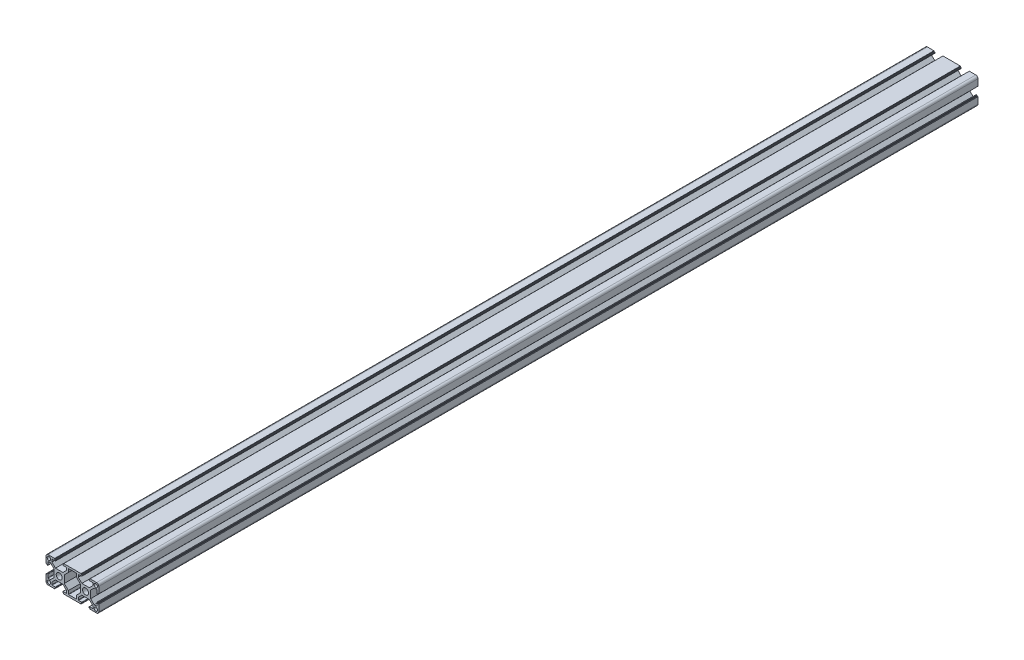
from build123d import *

# Parameters (mm, degrees)
SKETCH_1_R      = 2
SKETCH_1_R_2    = 3.4
EXTRUDE_1_DEPTH = 1000


with BuildPart() as part:
    # 草图1 → 凸台-拉伸1 (new body)
    with BuildSketch(Plane.XY):
        with BuildLine():
            Line((-10.924024871, 14.554539202), (-18.324024871, 14.554539202))
            Line((-18.324024871, 14.554539202), (-18.324024871, 13.754539202))
            ThreePointArc((-18.324024871, 13.754539202), (-18.382603515, 13.613117846), (-18.524024871, 13.554539202))
            Line((-18.524024871, 13.554539202), (-19.324024871, 13.554539202))
            Line((-19.324024871, 13.554539202), (-19.324024871, 12.654539202))
            ThreePointArc((-19.324024871, 12.654539202), (-19.236156905, 12.442407168), (-19.024024871, 12.354539202))
            Line((-19.024024871, 12.354539202), (-15.474024871, 12.354539202))
            ThreePointArc((-15.474024871, 12.354539202), (-15.261892836, 12.266671237), (-15.174024871, 12.054539202))
            Line((-15.174024871, 12.054539202), (-15.174024871, 9.360174121))
            Line((-15.174024871, 9.360174121), (-19.179659789, 5.354539202))
            Line((-19.179659789, 5.354539202), (-27.668389952, 5.354539202))
            Line((-27.668389952, 5.354539202), (-31.674024871, 9.360174121))
            Line((-31.674024871, 9.360174121), (-31.674024871, 12.054539202))
            ThreePointArc((-31.674024871, 12.054539202), (-31.586156905, 12.266671237), (-31.374024871, 12.354539202))
            Line((-31.374024871, 12.354539202), (-27.824024871, 12.354539202))
            ThreePointArc((-27.824024871, 12.354539202), (-27.611892836, 12.442407168), (-27.524024871, 12.654539202))
            Line((-27.524024871, 12.654539202), (-27.524024871, 13.554539202))
            Line((-27.524024871, 13.554539202), (-28.324024871, 13.554539202))
            ThreePointArc((-28.324024871, 13.554539202), (-28.465446227, 13.613117846), (-28.524024871, 13.754539202))
            Line((-28.524024871, 13.754539202), (-28.524024871, 14.554539202))
            Line((-28.524024871, 14.554539202), (-35.924024871, 14.554539202))
            ThreePointArc((-35.924024871, 14.554539202), (-37.691791824, 13.822306155), (-38.424024871, 12.054539202))
            Line((-38.424024871, 12.054539202), (-38.424024871, 4.654539202))
            Line((-38.424024871, 4.654539202), (-37.624024871, 4.654539202))
            ThreePointArc((-37.624024871, 4.654539202), (-37.482603515, 4.595960558), (-37.424024871, 4.454539202))
            Line((-37.424024871, 4.454539202), (-37.424024871, 3.654539202))
            Line((-37.424024871, 3.654539202), (-36.524024871, 3.654539202))
            ThreePointArc((-36.524024871, 3.654539202), (-36.311892836, 3.742407168), (-36.224024871, 3.954539202))
            Line((-36.224024871, 3.954539202), (-36.224024871, 7.504539202))
            ThreePointArc((-36.224024871, 7.504539202), (-36.136156905, 7.716671237), (-35.924024871, 7.804539202))
            Line((-35.924024871, 7.804539202), (-33.229659789, 7.804539202))
            Line((-33.229659789, 7.804539202), (-29.224024871, 3.798904284))
            Line((-29.224024871, 3.798904284), (-29.224024871, -4.689825879))
            Line((-29.224024871, -4.689825879), (-33.229659789, -8.695460798))
            Line((-33.229659789, -8.695460798), (-35.924024871, -8.695460798))
            ThreePointArc((-35.924024871, -8.695460798), (-36.136156905, -8.607592832), (-36.224024871, -8.395460798))
            Line((-36.224024871, -8.395460798), (-36.224024871, -4.845460798))
            ThreePointArc((-36.224024871, -4.845460798), (-36.311892836, -4.633328763), (-36.524024871, -4.545460798))
            Line((-36.524024871, -4.545460798), (-37.424024871, -4.545460798))
            Line((-37.424024871, -4.545460798), (-37.424024871, -5.345460798))
            ThreePointArc((-37.424024871, -5.345460798), (-37.482603515, -5.486882154), (-37.624024871, -5.545460798))
            Line((-37.624024871, -5.545460798), (-38.424024871, -5.545460798))
            Line((-38.424024871, -5.545460798), (-38.424024871, -12.945460798))
            ThreePointArc((-38.424024871, -12.945460798), (-37.691791824, -14.713227751), (-35.924024871, -15.445460798))
            Line((-35.924024871, -15.445460798), (-28.524024871, -15.445460798))
            Line((-28.524024871, -15.445460798), (-28.524024871, -14.645460798))
            ThreePointArc((-28.524024871, -14.645460798), (-28.465446227, -14.504039442), (-28.324024871, -14.445460798))
            Line((-28.324024871, -14.445460798), (-27.524024871, -14.445460798))
            Line((-27.524024871, -14.445460798), (-27.524024871, -13.545460798))
            ThreePointArc((-27.524024871, -13.545460798), (-27.611892836, -13.333328763), (-27.824024871, -13.245460798))
            Line((-27.824024871, -13.245460798), (-31.374024871, -13.245460798))
            ThreePointArc((-31.374024871, -13.245460798), (-31.586156905, -13.157592832), (-31.674024871, -12.945460798))
            Line((-31.674024871, -12.945460798), (-31.674024871, -10.251095716))
            Line((-31.674024871, -10.251095716), (-27.668389952, -6.245460798))
            Line((-27.668389952, -6.245460798), (-19.179659789, -6.245460798))
            Line((-19.179659789, -6.245460798), (-15.174024871, -10.251095716))
            Line((-15.174024871, -10.251095716), (-15.174024871, -12.945460798))
            ThreePointArc((-15.174024871, -12.945460798), (-15.261892836, -13.157592832), (-15.474024871, -13.245460798))
            Line((-15.474024871, -13.245460798), (-19.024024871, -13.245460798))
            ThreePointArc((-19.024024871, -13.245460798), (-19.236156905, -13.333328763), (-19.324024871, -13.545460798))
            Line((-19.324024871, -13.545460798), (-19.324024871, -14.445460798))
            Line((-19.324024871, -14.445460798), (-18.524024871, -14.445460798))
            ThreePointArc((-18.524024871, -14.445460798), (-18.382603515, -14.504039442), (-18.324024871, -14.645460798))
            Line((-18.324024871, -14.645460798), (-18.324024871, -15.445460798))
            Line((-18.324024871, -15.445460798), (-10.924024871, -15.445460798))
            Line((-10.924024871, -15.445460798), (-5.924024871, -15.445460798))
            Line((-5.924024871, -15.445460798), (1.475975129, -15.445460798))
            Line((1.475975129, -15.445460798), (1.475975129, -14.645460798))
            ThreePointArc((1.475975129, -14.645460798), (1.534553773, -14.504039442), (1.675975129, -14.445460798))
            Line((1.675975129, -14.445460798), (2.475975129, -14.445460798))
            Line((2.475975129, -14.445460798), (2.475975129, -13.545460798))
            ThreePointArc((2.475975129, -13.545460798), (2.388107164, -13.333328763), (2.175975129, -13.245460798))
            Line((2.175975129, -13.245460798), (-1.374024871, -13.245460798))
            ThreePointArc((-1.374024871, -13.245460798), (-1.586156905, -13.157592832), (-1.674024871, -12.945460798))
            Line((-1.674024871, -12.945460798), (-1.674024871, -10.251095716))
            Line((-1.674024871, -10.251095716), (2.331610048, -6.245460798))
            Line((2.331610048, -6.245460798), (10.820340211, -6.245460798))
            Line((10.820340211, -6.245460798), (14.825975129, -10.251095716))
            Line((14.825975129, -10.251095716), (14.825975129, -12.945460798))
            ThreePointArc((14.825975129, -12.945460798), (14.738107164, -13.157592832), (14.525975129, -13.245460798))
            Line((14.525975129, -13.245460798), (10.975975129, -13.245460798))
            ThreePointArc((10.975975129, -13.245460798), (10.763843095, -13.333328763), (10.675975129, -13.545460798))
            Line((10.675975129, -13.545460798), (10.675975129, -14.445460798))
            Line((10.675975129, -14.445460798), (11.475975129, -14.445460798))
            ThreePointArc((11.475975129, -14.445460798), (11.617396485, -14.504039442), (11.675975129, -14.645460798))
            Line((11.675975129, -14.645460798), (11.675975129, -15.445460798))
            Line((11.675975129, -15.445460798), (19.075975129, -15.445460798))
            ThreePointArc((19.075975129, -15.445460798), (20.843742082, -14.713227751), (21.575975129, -12.945460798))
            Line((21.575975129, -12.945460798), (21.575975129, -5.545460798))
            Line((21.575975129, -5.545460798), (20.775975129, -5.545460798))
            ThreePointArc((20.775975129, -5.545460798), (20.634553773, -5.486882154), (20.575975129, -5.345460798))
            Line((20.575975129, -5.345460798), (20.575975129, -4.545460798))
            Line((20.575975129, -4.545460798), (19.675975129, -4.545460798))
            ThreePointArc((19.675975129, -4.545460798), (19.463843095, -4.633328763), (19.375975129, -4.845460798))
            Line((19.375975129, -4.845460798), (19.375975129, -8.395460798))
            ThreePointArc((19.375975129, -8.395460798), (19.288107164, -8.607592832), (19.075975129, -8.695460798))
            Line((19.075975129, -8.695460798), (16.381610048, -8.695460798))
            Line((16.381610048, -8.695460798), (12.375975129, -4.689825879))
            Line((12.375975129, -4.689825879), (12.375975129, 3.798904284))
            Line((12.375975129, 3.798904284), (16.381610048, 7.804539202))
            Line((16.381610048, 7.804539202), (19.075975129, 7.804539202))
            ThreePointArc((19.075975129, 7.804539202), (19.288107164, 7.716671237), (19.375975129, 7.504539202))
            Line((19.375975129, 7.504539202), (19.375975129, 3.954539202))
            ThreePointArc((19.375975129, 3.954539202), (19.463843095, 3.742407168), (19.675975129, 3.654539202))
            Line((19.675975129, 3.654539202), (20.575975129, 3.654539202))
            Line((20.575975129, 3.654539202), (20.575975129, 4.454539202))
            ThreePointArc((20.575975129, 4.454539202), (20.634553773, 4.595960558), (20.775975129, 4.654539202))
            Line((20.775975129, 4.654539202), (21.575975129, 4.654539202))
            Line((21.575975129, 4.654539202), (21.575975129, 12.054539202))
            ThreePointArc((21.575975129, 12.054539202), (20.843742082, 13.822306155), (19.075975129, 14.554539202))
            Line((19.075975129, 14.554539202), (11.675975129, 14.554539202))
            Line((11.675975129, 14.554539202), (11.675975129, 13.754539202))
            ThreePointArc((11.675975129, 13.754539202), (11.617396485, 13.613117846), (11.475975129, 13.554539202))
            Line((11.475975129, 13.554539202), (10.675975129, 13.554539202))
            Line((10.675975129, 13.554539202), (10.675975129, 12.654539202))
            ThreePointArc((10.675975129, 12.654539202), (10.763843095, 12.442407168), (10.975975129, 12.354539202))
            Line((10.975975129, 12.354539202), (14.525975129, 12.354539202))
            ThreePointArc((14.525975129, 12.354539202), (14.738107164, 12.266671237), (14.825975129, 12.054539202))
            Line((14.825975129, 12.054539202), (14.825975129, 9.360174121))
            Line((14.825975129, 9.360174121), (10.820340211, 5.354539202))
            Line((10.820340211, 5.354539202), (2.331610048, 5.354539202))
            Line((2.331610048, 5.354539202), (-1.674024871, 9.360174121))
            Line((-1.674024871, 9.360174121), (-1.674024871, 12.054539202))
            ThreePointArc((-1.674024871, 12.054539202), (-1.586156905, 12.266671237), (-1.374024871, 12.354539202))
            Line((-1.374024871, 12.354539202), (2.175975129, 12.354539202))
            ThreePointArc((2.175975129, 12.354539202), (2.388107164, 12.442407168), (2.475975129, 12.654539202))
            Line((2.475975129, 12.654539202), (2.475975129, 13.554539202))
            Line((2.475975129, 13.554539202), (1.675975129, 13.554539202))
            ThreePointArc((1.675975129, 13.554539202), (1.534553773, 13.613117846), (1.475975129, 13.754539202))
            Line((1.475975129, 13.754539202), (1.475975129, 14.554539202))
            Line((1.475975129, 14.554539202), (-5.924024871, 14.554539202))
            Line((-5.924024871, 14.554539202), (-10.924024871, 14.554539202))
        make_face()
        with Locations((18.200975129, -12.070460798)):
            Circle(SKETCH_1_R, mode=Mode.SUBTRACT)
        with Locations((18.200975129, 11.179539202)):
            Circle(SKETCH_1_R, mode=Mode.SUBTRACT)
        with Locations((6.575975129, -0.445460798)):
            Circle(SKETCH_1_R_2, mode=Mode.SUBTRACT)
        with Locations((-35.049024871, -12.070460798)):
            Circle(SKETCH_1_R, mode=Mode.SUBTRACT)
        with Locations((-35.049024871, 11.179539202)):
            Circle(SKETCH_1_R, mode=Mode.SUBTRACT)
        with Locations((-23.424024871, -0.445460798)):
            Circle(SKETCH_1_R_2, mode=Mode.SUBTRACT)
        with BuildLine():
            Line((-17.624024871, -4.689825879), (-17.624024871, 3.798904284))
            Line((-17.624024871, 3.798904284), (-12.974024871, 8.448904284))
            Line((-12.974024871, 8.448904284), (-12.974024871, 12.054539202))
            ThreePointArc((-12.974024871, 12.054539202), (-12.886156905, 12.266671237), (-12.674024871, 12.354539202))
            Line((-12.674024871, 12.354539202), (-4.174024871, 12.354539202))
            ThreePointArc((-4.174024871, 12.354539202), (-3.961892836, 12.266671237), (-3.874024871, 12.054539202))
            Line((-3.874024871, 12.054539202), (-3.874024871, 8.448904284))
            Line((-3.874024871, 8.448904284), (0.775975129, 3.798904284))
            Line((0.775975129, 3.798904284), (0.775975129, -4.689825879))
            Line((0.775975129, -4.689825879), (-3.874024871, -9.339825879))
            Line((-3.874024871, -9.339825879), (-3.874024871, -12.945460798))
            ThreePointArc((-3.874024871, -12.945460798), (-3.961892836, -13.157592832), (-4.174024871, -13.245460798))
            Line((-4.174024871, -13.245460798), (-12.674024871, -13.245460798))
            ThreePointArc((-12.674024871, -13.245460798), (-12.886156905, -13.157592832), (-12.974024871, -12.945460798))
            Line((-12.974024871, -12.945460798), (-12.974024871, -9.339825879))
            Line((-12.974024871, -9.339825879), (-17.624024871, -4.689825879))
        make_face(mode=Mode.SUBTRACT)
    extrude(amount=EXTRUDE_1_DEPTH)


solid = part.part
